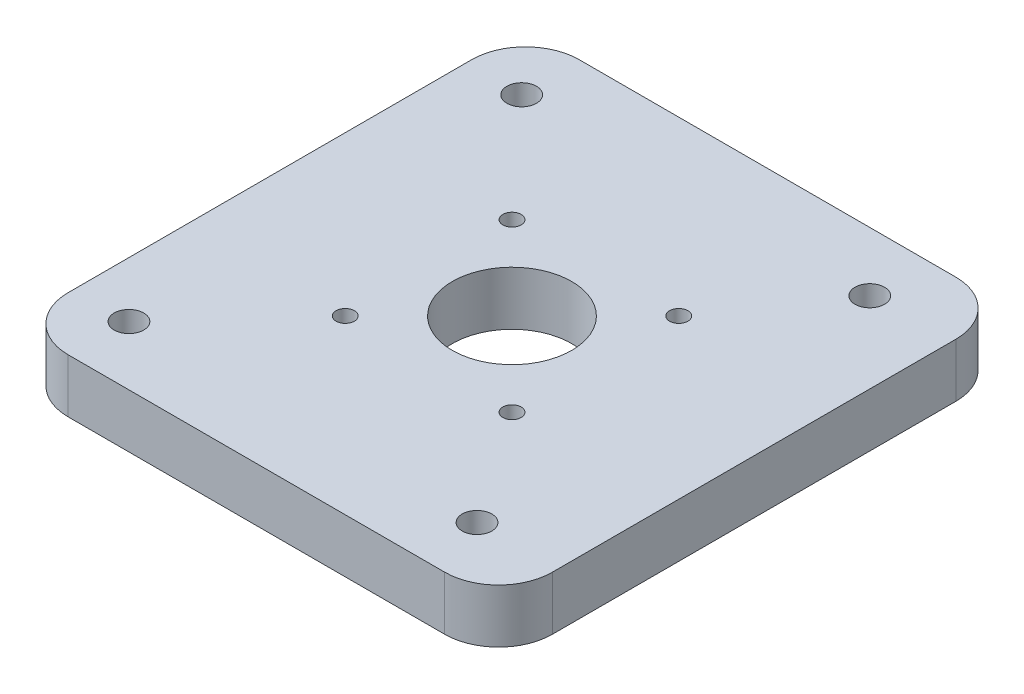
from build123d import *

# Parameters (mm, degrees)
SKETCH1_R                                        = 11.1
SKETCH1_R_2                                      = 1.5
BOSS_EXTRUDE1_DEPTH                              = 10
CBORE_FOR_M3_SHCS2_D                             = 3.4
CBORE_FOR_M3_SHCS2_CBORE_D                       = 6.5
CBORE_FOR_M3_SHCS2_CBORE_DEPTH                   = 3
BOSS_EXTRUDE2_DEPTH                              = 15
CBORE_FOR_M5_PAN_HEAD_MACHINE_SCREW1_D           = 5.5
CBORE_FOR_M5_PAN_HEAD_MACHINE_SCREW1_CBORE_D     = 11
CBORE_FOR_M5_PAN_HEAD_MACHINE_SCREW1_CBORE_DEPTH = 3.7


with BuildPart() as part:
    # Sketch1 → Boss-Extrude1 (new body)
    with BuildSketch(Plane(origin=(0, 0, 0), x_dir=(1, 0, 0), z_dir=(0, 1, 0))):
        with BuildLine():
            Line((-53.392463057, 46.326821798), (16.607536943, 46.326821798))
            ThreePointArc((16.607536943, 46.326821798), (23.678604755, 43.39788961), (26.607536943, 36.326821798))
            Line((26.607536943, 36.326821798), (26.607536943, -38.673178202))
            ThreePointArc((26.607536943, -38.673178202), (23.678604755, -45.744246014), (16.607536943, -48.673178202))
            Line((16.607536943, -48.673178202), (-53.392463057, -48.673178202))
            ThreePointArc((-53.392463057, -48.673178202), (-60.463530869, -45.744246014), (-63.392463057, -38.673178202))
            Line((-63.392463057, -38.673178202), (-63.392463057, 36.326821798))
            ThreePointArc((-63.392463057, 36.326821798), (-60.463530869, 43.39788961), (-53.392463057, 46.326821798))
        make_face()
        with Locations(Location((-18.392463057, -1.173178202, 0), (0, 0, 270))):
            Circle(SKETCH1_R, mode=Mode.SUBTRACT)
        with Locations(Location((-33.892463057, 14.326821798, 0), (0, 0, 270))):
            Circle(SKETCH1_R_2, mode=Mode.SUBTRACT)
        with Locations(Location((-2.892463057, 14.326821798, 0), (0, 0, 270))):
            Circle(SKETCH1_R_2, mode=Mode.SUBTRACT)
        with Locations(Location((-2.892463057, -16.673178202, 0), (0, 0, 270))):
            Circle(SKETCH1_R_2, mode=Mode.SUBTRACT)
        with Locations(Location((-33.892463057, -16.673178202, 0), (0, 0, 270))):
            Circle(SKETCH1_R_2, mode=Mode.SUBTRACT)
    extrude(amount=BOSS_EXTRUDE1_DEPTH)

    # CBORE for M3 SHCS2 (through all)
    with Locations(Plane(origin=(0, 0, 0), x_dir=(-1, 0, 0), z_dir=(0, -1, 0))):
        with Locations((33.892463057, 14.326821798), (33.892463057, -16.673178202), (2.892463057, -16.673178202), (2.892463057, 14.326821798)):
            CounterBoreHole(CBORE_FOR_M3_SHCS2_D / 2, CBORE_FOR_M3_SHCS2_CBORE_D / 2, CBORE_FOR_M3_SHCS2_CBORE_DEPTH)

    # Sketch14 → Boss-Extrude2 (add)
    with BuildSketch(Plane.XZ):
        with BuildLine():
            Line((-63.392463057, 21.173178202), (-63.392463057, 1.173178202))
            Line((-63.392463057, 1.173178202), (-45.24346378, 1.173178202))
            Line((-45.24346378, 1.173178202), (-45.24346378, 8.863568164))
            ThreePointArc((-45.24346378, 8.863568164), (-45.969681105, 12.604818608), (-48.042854757, 15.802676874))
            ThreePointArc((-48.042854757, 15.802676874), (-48.11206031, 15.853300063), (-48.194300833, 15.877561399))
            ThreePointArc((-48.194300833, 15.877561399), (-49.229807613, 16.702257146), (-48.943751594, 17.994762203))
            ThreePointArc((-48.943751594, 17.994762203), (-48.890905547, 18.264697041), (-49.118059331, 18.419805648))
            ThreePointArc((-49.118059331, 18.419805648), (-49.185476717, 18.420979486), (-49.252892133, 18.422261555))
            ThreePointArc((-49.252892133, 18.422261555), (-49.413697771, 18.367785226), (-49.502621898, 18.223152506))
            ThreePointArc((-49.502621898, 18.223152506), (-50.795128099, 17.229247149), (-51.970871232, 18.358870194))
            ThreePointArc((-51.970871232, 18.358870194), (-52.04340184, 18.512380567), (-52.197265304, 18.584159104))
            ThreePointArc((-52.197265304, 18.584159104), (-52.222766522, 18.586469356), (-52.248266326, 18.588795154))
            ThreePointArc((-52.248266326, 18.588795154), (-52.412550431, 18.545936584), (-52.511572027, 18.408020497))
            ThreePointArc((-52.511572027, 18.408020497), (-53.871728968, 17.508913587), (-54.963836872, 18.719583015))
            ThreePointArc((-54.963836872, 18.719583015), (-55.025224421, 18.877879234), (-55.173571608, 18.960457898))
            ThreePointArc((-55.173571608, 18.960457898), (-55.178476777, 18.961257271), (-55.183381852, 18.962057224))
            ThreePointArc((-55.183381852, 18.962057224), (-55.402367129, 18.890120336), (-55.46941862, 18.669590145))
            ThreePointArc((-55.46941862, 18.669590145), (-56.940189657, 17.214565757), (-57.748415424, 19.11904325))
            ThreePointArc((-57.748415424, 19.11904325), (-57.726719012, 19.348518158), (-57.901995791, 19.498209567))
            ThreePointArc((-57.901995791, 19.498209567), (-57.906837309, 19.499331791), (-57.911678694, 19.500454589))
            ThreePointArc((-57.911678694, 19.500454589), (-58.080270451, 19.480381142), (-58.197160956, 19.357244089))
            ThreePointArc((-58.197160956, 19.357244089), (-59.765354714, 18.68269589), (-60.54412767, 20.201827096))
            ThreePointArc((-60.54412767, 20.201827096), (-61.976998133, 20.661983137), (-63.392463057, 21.173178202))
        make_face()
        with BuildLine():
            Line((-63.392463057, 1.173178202), (-63.392463057, -18.826821798))
            ThreePointArc((-63.392463057, -18.826821798), (-61.976998133, -18.315626732), (-60.54412767, -17.855470691))
            ThreePointArc((-60.54412767, -17.855470691), (-59.765354714, -16.336339486), (-58.197160956, -17.010887685))
            ThreePointArc((-58.197160956, -17.010887685), (-58.080270451, -17.134024738), (-57.911678694, -17.154098184))
            ThreePointArc((-57.911678694, -17.154098184), (-57.906837309, -17.152975387), (-57.901995791, -17.151853162))
            ThreePointArc((-57.901995791, -17.151853162), (-57.726719012, -17.002161753), (-57.748415424, -16.772686846))
            ThreePointArc((-57.748415424, -16.772686846), (-56.940189657, -14.868209353), (-55.46941862, -16.323233741))
            ThreePointArc((-55.46941862, -16.323233741), (-55.402367129, -16.543763931), (-55.183381852, -16.615700819))
            ThreePointArc((-55.183381852, -16.615700819), (-55.178476777, -16.614900866), (-55.173571608, -16.614101494))
            ThreePointArc((-55.173571608, -16.614101494), (-55.025224421, -16.531522829), (-54.963836872, -16.373226611))
            ThreePointArc((-54.963836872, -16.373226611), (-53.871728968, -15.162557182), (-52.511572027, -16.061664092))
            ThreePointArc((-52.511572027, -16.061664092), (-52.412550431, -16.19958018), (-52.248266326, -16.242438749))
            ThreePointArc((-52.248266326, -16.242438749), (-52.222766522, -16.240112951), (-52.197265304, -16.2378027))
            ThreePointArc((-52.197265304, -16.2378027), (-52.04340184, -16.166024163), (-51.970871232, -16.012513789))
            ThreePointArc((-51.970871232, -16.012513789), (-50.795128099, -14.882890744), (-49.502621898, -15.876796101))
            ThreePointArc((-49.502621898, -15.876796101), (-49.413697771, -16.021428821), (-49.252892133, -16.07590515))
            ThreePointArc((-49.252892133, -16.07590515), (-49.185476717, -16.074623081), (-49.118059331, -16.073449243))
            ThreePointArc((-49.118059331, -16.073449243), (-48.890905547, -15.918340637), (-48.943751594, -15.648405799))
            ThreePointArc((-48.943751594, -15.648405799), (-49.229807613, -14.355900742), (-48.194300833, -13.531204995))
            ThreePointArc((-48.194300833, -13.531204995), (-48.11206031, -13.506943659), (-48.042854757, -13.45632047))
            ThreePointArc((-48.042854757, -13.45632047), (-45.969681105, -10.258462203), (-45.24346378, -6.517211759))
            Line((-45.24346378, -6.517211759), (-45.24346378, 1.173178202))
            Line((-45.24346378, 1.173178202), (-63.392463057, 1.173178202))
        make_face()
    extrude(amount=BOSS_EXTRUDE2_DEPTH)

    # CBORE for M5 Pan Head Machine Screw1 (through all)
    with Locations(Plane(origin=(0, 0, 0), x_dir=(-1, 0, 0), z_dir=(0, -1, 0))):
        with Locations((53.091066757, 35.326821798), (-11.607536943, 35.326821798), (-11.607536943, -37.673178202), (53.091066757, -37.673178202)):
            CounterBoreHole(CBORE_FOR_M5_PAN_HEAD_MACHINE_SCREW1_D / 2, CBORE_FOR_M5_PAN_HEAD_MACHINE_SCREW1_CBORE_D / 2, CBORE_FOR_M5_PAN_HEAD_MACHINE_SCREW1_CBORE_DEPTH)


solid = part.part
